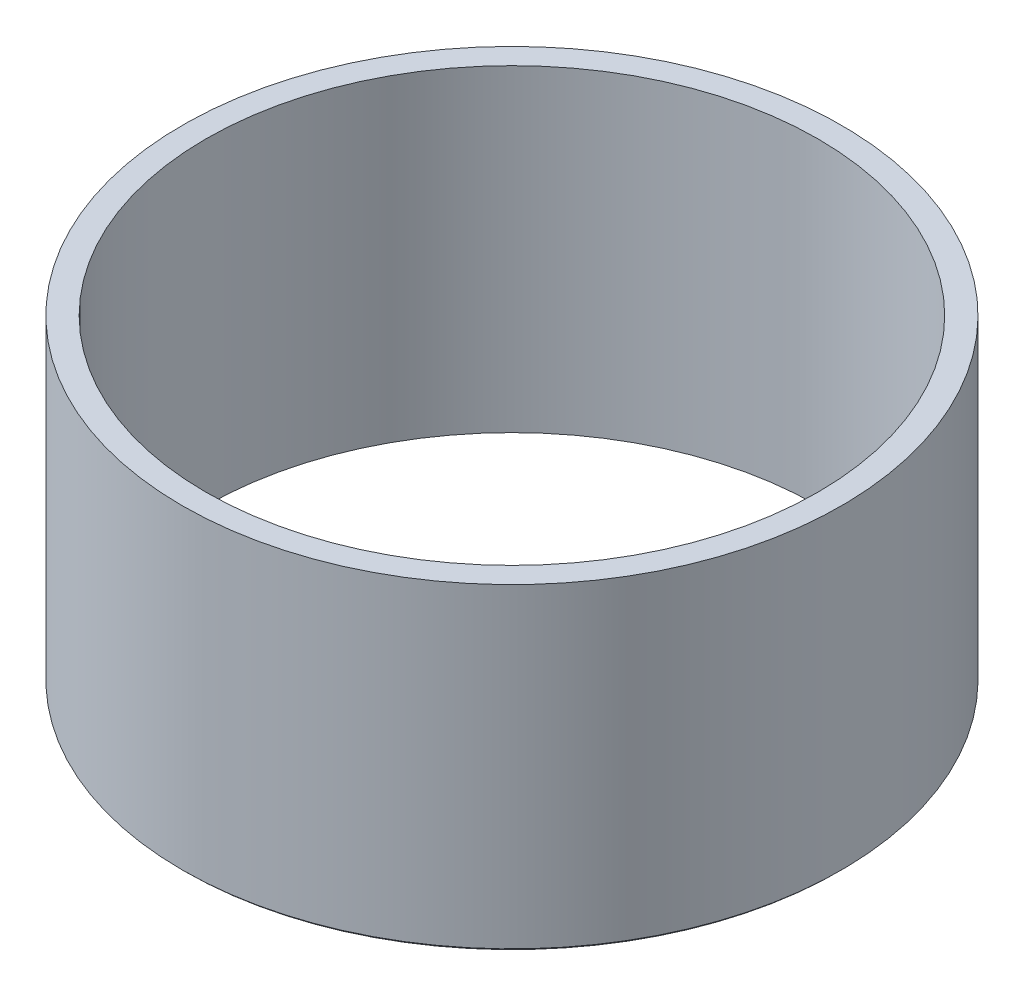
from build123d import *

# Parameters (mm, degrees)
CROQUIS1_R              = 14
CROQUIS1_R_2            = 13
SALIENTE_EXTRUIR1_DEPTH = 13.5
CHAFL_N1_SIZE           = 0.1


with BuildPart() as part:
    # Croquis1 → Saliente-Extruir1 (new body)
    with BuildSketch(Plane(origin=(0, 0, 0), x_dir=(1, 0, 0), z_dir=(0, 1, 0))):
        with Locations(Location((0, 0, 0), (0, 0, 270))):
            Circle(CROQUIS1_R)
        with Locations(Location((0, 0, 0), (0, 0, 270))):
            Circle(CROQUIS1_R_2, mode=Mode.SUBTRACT)
    extrude(amount=SALIENTE_EXTRUIR1_DEPTH)

    # Chaflán1
    chafl_n1_edges = [part.edges().sort_by_distance(p)[0] for p in [
        (0, 0, -14),
    ]]
    chamfer(chafl_n1_edges, length=CHAFL_N1_SIZE)


solid = part.part
